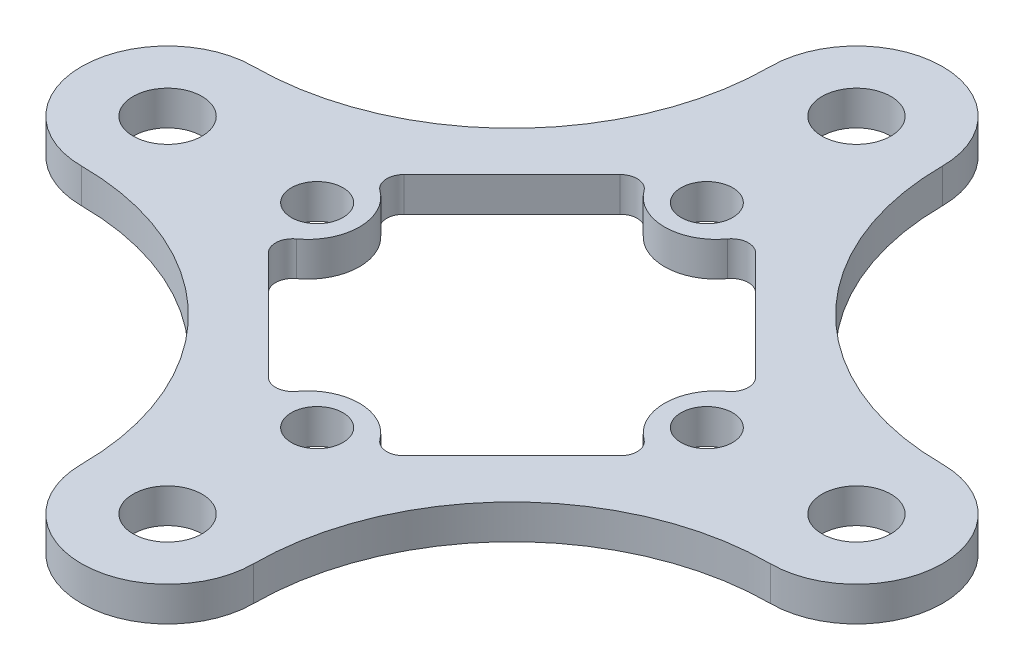
from build123d import *

# Parameters (mm, degrees)
BOSS_EXTRUDE1_DEPTH = 2
CIRPATTERN1_COUNT   = 4
SKETCH2_R           = 1.5
SKETCH2_R_2         = 2
CUT_EXTRUDE1_DEPTH  = 2
CUT_EXTRUDE2_DEPTH  = 2
FILLET2_R           = 1


with BuildPart() as part:
    # Sketch1 → Boss-Extrude1 (new body)
    with BuildSketch(Plane(origin=(0, 0, 0), x_dir=(1, 0, 0), z_dir=(0, 1, 0))):
        with BuildLine():
            Line((0, 25), (0, 0))
            Line((0, 0), (25, 0))
            ThreePointArc((25, 0), (23.535533906, 3.535533906), (20, 5))
            ThreePointArc((20, 5), (9.393398282, 9.393398282), (5, 20))
            ThreePointArc((5, 20), (3.535533906, 23.535533906), (0, 25))
        make_face()
    boss_extrude1 = extrude(amount=BOSS_EXTRUDE1_DEPTH)

    # CirPattern1: Boss-Extrude1 ×4 about axis
    cirpattern1_axis = Axis((0, 0, 0), (0, 1, 0))
    for i in range(1, CIRPATTERN1_COUNT):
        add(boss_extrude1.rotate(cirpattern1_axis, i * 360 / CIRPATTERN1_COUNT))

    # Sketch2 → Cut-Extrude1 (cut)
    with BuildSketch(Plane(origin=(0, 2, 0), x_dir=(1, 0, 0), z_dir=(0, 1, 0))):
        with Locations(Location((0, 11.313708499, 0), (0, 0, 270))):
            Circle(SKETCH2_R)
        with Locations(Location((0, 20, 0), (0, 0, 270))):
            Circle(SKETCH2_R_2)
        with Locations(Location((11.313708499, 0, 0), (0, 0, 270))):
            Circle(SKETCH2_R)
        with Locations(Location((20, 0, 0), (0, 0, 270))):
            Circle(SKETCH2_R_2)
        with Locations(Location((0, -11.313708499, 0), (0, 0, 270))):
            Circle(SKETCH2_R)
        with Locations(Location((0, -20, 0), (0, 0, 270))):
            Circle(SKETCH2_R_2)
        with Locations(Location((-11.313708499, 0, 0), (0, 0, 270))):
            Circle(SKETCH2_R)
        with Locations(Location((-20, 0, 0), (0, 0, 270))):
            Circle(SKETCH2_R_2)
    extrude(amount=-CUT_EXTRUDE1_DEPTH, mode=Mode.SUBTRACT)

    # Sketch3 → Cut-Extrude2 (cut)
    with BuildSketch(Plane(origin=(0, 2, 0), x_dir=(1, 0, 0), z_dir=(0, 1, 0))):
        with BuildLine():
            Line((-11.212704416, 2.929431208), (-2.929431208, 11.212704416))
            ThreePointArc((-2.929431208, 11.212704416), (0, 8.859568233), (2.929431208, 11.212704416))
            Line((2.929431208, 11.212704416), (11.212704416, 2.929431208))
            ThreePointArc((11.212704416, 2.929431208), (8.859568233, 0), (11.212704416, -2.929431208))
            Line((11.212704416, -2.929431208), (2.929431208, -11.212704416))
            ThreePointArc((2.929431208, -11.212704416), (0, -8.859568233), (-2.929431208, -11.212704416))
            Line((-2.929431208, -11.212704416), (-11.212704416, -2.929431208))
            ThreePointArc((-11.212704416, -2.929431208), (-8.859568233, 0), (-11.212704416, 2.929431208))
        make_face()
    extrude(amount=-CUT_EXTRUDE2_DEPTH, mode=Mode.SUBTRACT)

    # Fillet2
    fillet2_edges = [part.edges().sort_by_distance(p)[0] for p in [
        (-11.212704416, 1, 2.929431208),
        (-11.212704416, 1, -2.929431208),
        (-2.929431208, 1, -11.212704416),
        (2.929431208, 1, -11.212704416),
        (11.212704416, 1, -2.929431208),
        (11.212704416, 1, 2.929431208),
        (2.929431208, 1, 11.212704416),
        (-2.929431208, 1, 11.212704416),
    ]]
    fillet(fillet2_edges, radius=FILLET2_R)


solid = part.part
